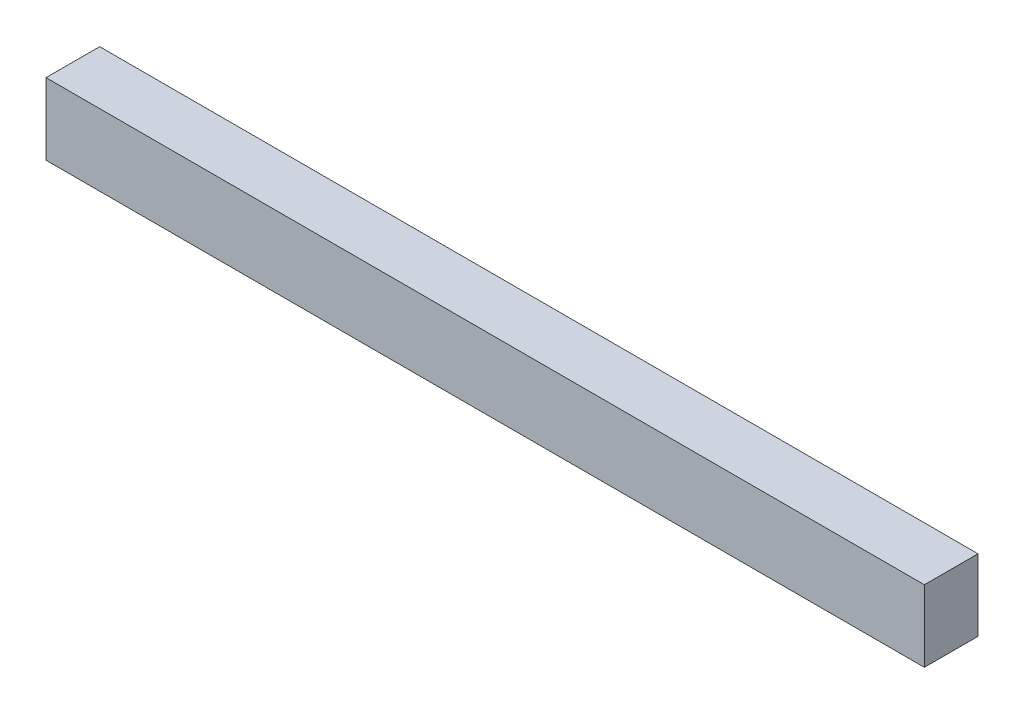
from build123d import *

# Parameters (mm, degrees)
SKETCH1_W      = 155.956
SKETCH1_H      = 12.7
EXTRUDE1_DEPTH = 4.7625


with BuildPart() as part:
    # Sketch1 → Extrude1 (new, symmetric)
    with BuildSketch(Plane.XY):
        Rectangle(SKETCH1_W, SKETCH1_H)
    extrude(amount=EXTRUDE1_DEPTH, both=True)


solid = part.part
